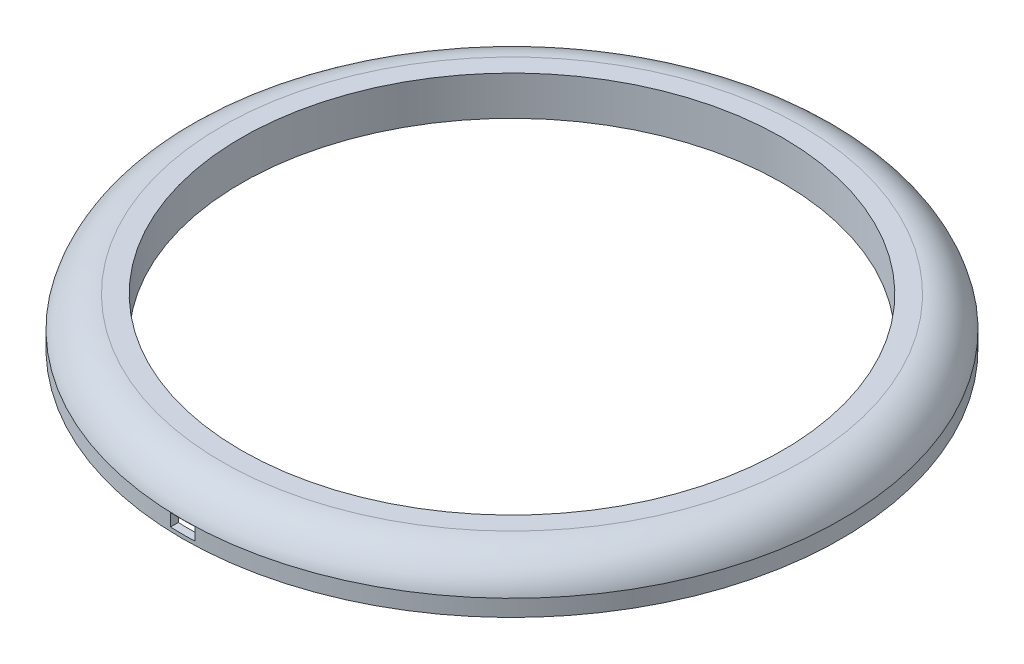
from build123d import *

# Parameters (mm, degrees)
SKETCH_2_W               = 3.1
SKETCH_2_H               = 1.6
CUT_EXTRUDE_1_DEPTH      = 5
PATTERN_CIRCULAR_2_COUNT = 2


with BuildPart() as part:
    # Эскиз1 → Повернуть1 (revolve)
    with BuildSketch(Plane(origin=(0, 0, 0), x_dir=(0, 0, -1), z_dir=(1, 0, 0))):
        with BuildLine():
            Line((36, 0), (36, 3))
            Line((36, 3), (38, 3))
            ThreePointArc((38, 3), (39.809588321, 2.464382482), (41, 1))
            Line((41, 1), (41, -1))
            Line((41, -1), (42, -1))
            Line((42, -1), (42, 1.115227568))
            ThreePointArc((42, 1.115227568), (40.165890745, 3.914666233), (37, 5))
            Line((37, 5), (34.5, 5))
            Line((34.5, 5), (34.5, 0))
            Line((34.5, 0), (36, 0))
        make_face()
    revolve(axis=Axis((0, 0, 0), (0, 1, 0)))

    # Эскиз2 → Вырез-Вытянуть1 (cut)
    with BuildSketch(Plane(origin=(0, 0, -42), x_dir=(-1, 0, 0), z_dir=(0, 0, -1))):
        with Locations((0, 0.3)):
            Rectangle(SKETCH_2_W, SKETCH_2_H)
    cut_extrude_1 = extrude(amount=-CUT_EXTRUDE_1_DEPTH, mode=Mode.SUBTRACT)

    # Круговой массив2: Вырез-Вытянуть1 ×2 about axis
    pattern_circular_2_axis = Axis((0, 0, 0), (0, -1, 0))
    for i in range(1, PATTERN_CIRCULAR_2_COUNT):
        add(cut_extrude_1.rotate(pattern_circular_2_axis, i * 360 / PATTERN_CIRCULAR_2_COUNT), mode=Mode.SUBTRACT)


solid = part.part
